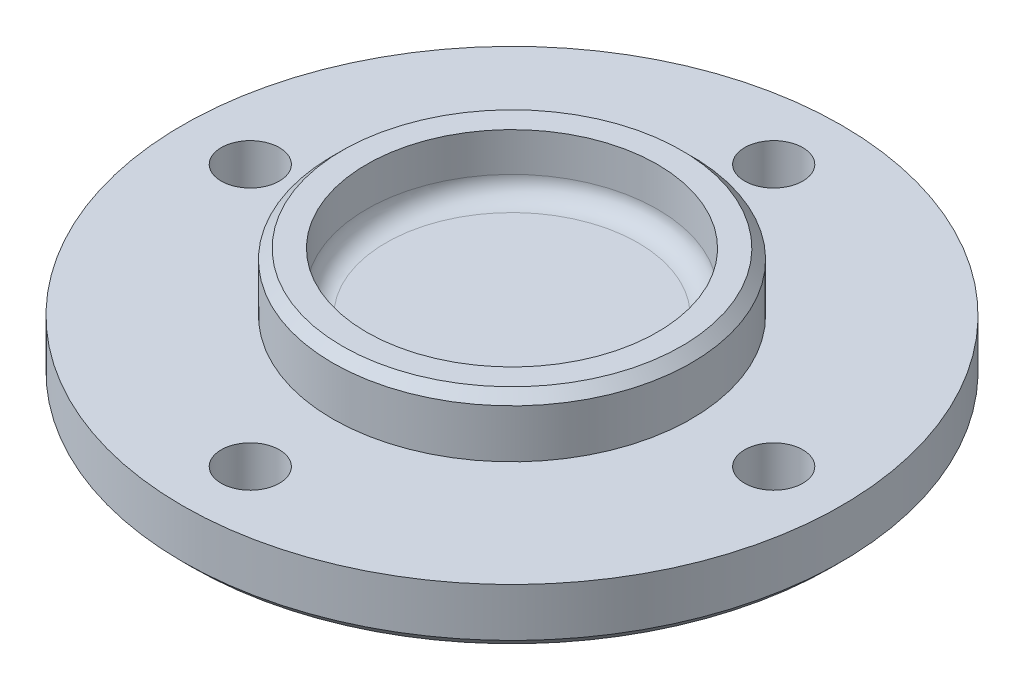
from build123d import *

# Parameters (mm, degrees)
SKETCH_1_R               = 34
EXTRUDE_1_DEPTH          = 6
SKETCH_2_R               = 18.5
SKETCH_2_R_2             = 15
EXTRUDE_2_DEPTH          = 6
SKETCH_5_R               = 3
CUT_EXTRUDE_1_DEPTH      = 6
PATTERN_CIRCULAR_1_COUNT = 4
FILLET_1_R               = 2
CHAMFER_1_SIZE           = 1


with BuildPart() as part:
    # 草图1 → 凸台-拉伸1 (new body)
    with BuildSketch(Plane(origin=(0, 0, 0), x_dir=(1, 0, 0), z_dir=(0, 1, 0))):
        with Locations(Location((0, 0, 0), (0, 0, 270))):
            Circle(SKETCH_1_R)
    extrude(amount=EXTRUDE_1_DEPTH)

    # 草图2 → 凸台-拉伸2 (add)
    with BuildSketch(Plane(origin=(0, 6, 0), x_dir=(1, 0, 0), z_dir=(0, 1, 0))):
        with Locations(Location((0, 0, 0), (0, 0, 270))):
            Circle(SKETCH_2_R)
        with Locations(Location((0, 0, 0), (0, 0, 270))):
            Circle(SKETCH_2_R_2, mode=Mode.SUBTRACT)
    extrude(amount=EXTRUDE_2_DEPTH)

    # 草图5 → 切除-拉伸1 (cut)
    with BuildSketch(Plane(origin=(0, 6, 0), x_dir=(1, 0, 0), z_dir=(0, 1, 0))):
        with Locations(Location((0, 27, 0), (0, 0, 270))):
            Circle(SKETCH_5_R)
    cut_extrude_1 = extrude(amount=-CUT_EXTRUDE_1_DEPTH, mode=Mode.SUBTRACT)

    # 阵列(圆周)1: 切除-拉伸1 ×4 about axis
    pattern_circular_1_axis = Axis((0, 0, 0), (0, 1, 0))
    for i in range(1, PATTERN_CIRCULAR_1_COUNT):
        add(cut_extrude_1.rotate(pattern_circular_1_axis, i * 360 / PATTERN_CIRCULAR_1_COUNT), mode=Mode.SUBTRACT)

    # 圆角1
    fillet_1_edges = [part.edges().sort_by_distance(p)[0] for p in [
        (0, 6, -15),
    ]]
    fillet(fillet_1_edges, radius=FILLET_1_R)

    # 倒角1
    chamfer_1_edges = [part.edges().sort_by_distance(p)[0] for p in [
        (0, 12, -18.5),
        (0, 0, -34),
    ]]
    chamfer(chamfer_1_edges, length=CHAMFER_1_SIZE)


solid = part.part
